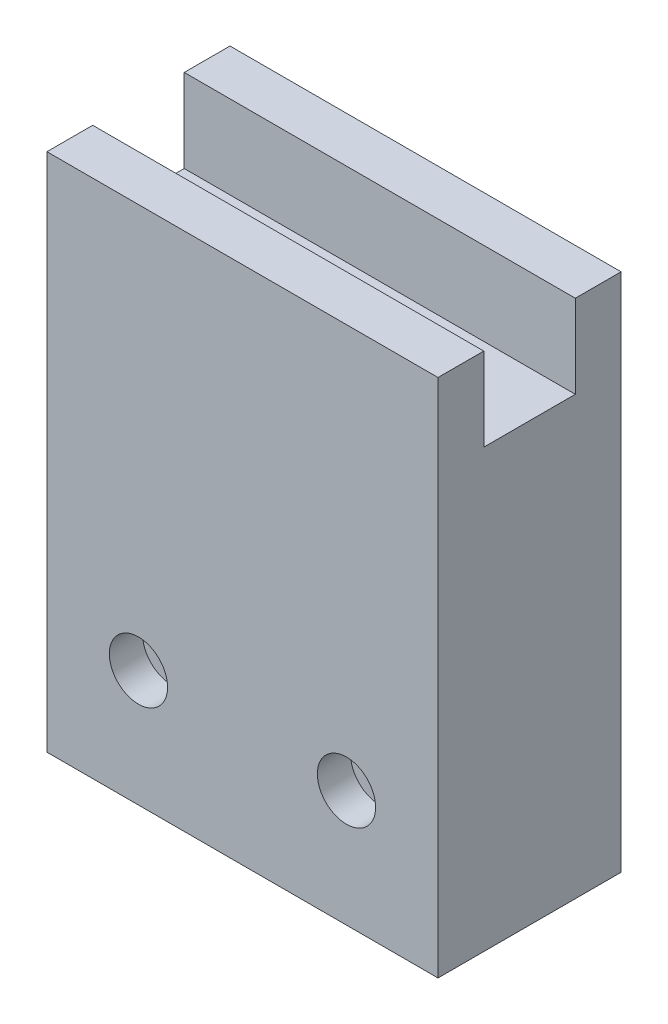
from build123d import *

# Parameters (mm, degrees)
SKETCH1_W               = 47
SKETCH1_H               = 62.5
BOSS_EXTRUDE1_DEPTH     = 22
SKETCH2_W               = 60
SKETCH2_H               = 11
CUT_EXTRUDE1_DEPTH      = 10
CUT_EXTRUDE2_DEPTH      = 82.235767984
CUT_EXTRUDE2_DEPTH_BACK = 82.235767984
SKETCH3_R               = 2
CUT_EXTRUDE3_DEPTH      = 82.235767984
CUT_EXTRUDE3_DEPTH_BACK = 4
SKETCH3_3_R             = 3.5
SKETCH3_3_R_2           = 2
SKETCH4_R               = 1.5
CUT_EXTRUDE6_DEPTH      = 13
SKETCH4_3_R             = 2.5
SKETCH4_3_R_2           = 1.5
CUT_EXTRUDE7_DEPTH      = 4


with BuildPart() as part:
    # Sketch1 → Boss-Extrude1 (new body)
    with BuildSketch(Plane.XY):
        with Locations((-23.5, 31.25)):
            Rectangle(SKETCH1_W, SKETCH1_H)
    extrude(amount=BOSS_EXTRUDE1_DEPTH)

    # Sketch2 → Cut-Extrude1 (cut)
    with BuildSketch(Plane(origin=(0, 62.5, 0), x_dir=(1, 0, 0), z_dir=(0, 1, 0))):
        with Locations((-23.5, -11)):
            Rectangle(SKETCH2_W, SKETCH2_H)
    extrude(amount=-CUT_EXTRUDE1_DEPTH, mode=Mode.SUBTRACT)

    # Sketch3 → Cut-Extrude2 (cut, two sides: drawn at the far end of the back side and taken through both)
    with BuildSketch(Plane.XY.offset(22).offset(-CUT_EXTRUDE2_DEPTH_BACK)):
        with Locations((-36, 14)):
            Circle(SKETCH3_R)
        with Locations((-11, 14)):
            Circle(SKETCH3_R)
    extrude(amount=CUT_EXTRUDE2_DEPTH + CUT_EXTRUDE2_DEPTH_BACK, mode=Mode.SUBTRACT)

    # Sketch3<3> → Cut-Extrude3 (cut, two sides: drawn at the far end of the back side and taken through both)
    # profile 1 of 2: a face of its own
    with BuildSketch(Plane.XY.offset(22).offset(-CUT_EXTRUDE3_DEPTH_BACK)):
        with Locations((-36, 14)):
            Circle(SKETCH3_3_R)
        with Locations((-36, 14)):
            Circle(SKETCH3_3_R_2, mode=Mode.SUBTRACT)
    # profile 2 of 2: a face of its own
    with BuildSketch(Plane.XY.offset(22).offset(-CUT_EXTRUDE3_DEPTH_BACK)):
        with Locations((-11, 14)):
            Circle(SKETCH3_3_R)
        with Locations((-11, 14)):
            Circle(SKETCH3_3_R_2, mode=Mode.SUBTRACT)
    extrude(amount=CUT_EXTRUDE3_DEPTH + CUT_EXTRUDE3_DEPTH_BACK, mode=Mode.SUBTRACT)

    # Sketch4 → Cut-Extrude6 (cut)
    with BuildSketch(Plane.XZ):
        with Locations((-36, 11)):
            Circle(SKETCH4_R)
        with Locations((-11, 11)):
            Circle(SKETCH4_R)
    extrude(amount=-CUT_EXTRUDE6_DEPTH, mode=Mode.SUBTRACT)

    # Sketch4<3> → Cut-Extrude7 (cut)
    # profile 1 of 2: a face of its own
    with BuildSketch(Plane.XZ):
        with Locations((-36, 11)):
            Circle(SKETCH4_3_R)
        with Locations((-36, 11)):
            Circle(SKETCH4_3_R_2, mode=Mode.SUBTRACT)
    # profile 2 of 2: a face of its own
    with BuildSketch(Plane.XZ):
        with Locations((-11, 11)):
            Circle(SKETCH4_3_R)
        with Locations((-11, 11)):
            Circle(SKETCH4_3_R_2, mode=Mode.SUBTRACT)
    extrude(amount=-CUT_EXTRUDE7_DEPTH, mode=Mode.SUBTRACT)


solid = part.part
